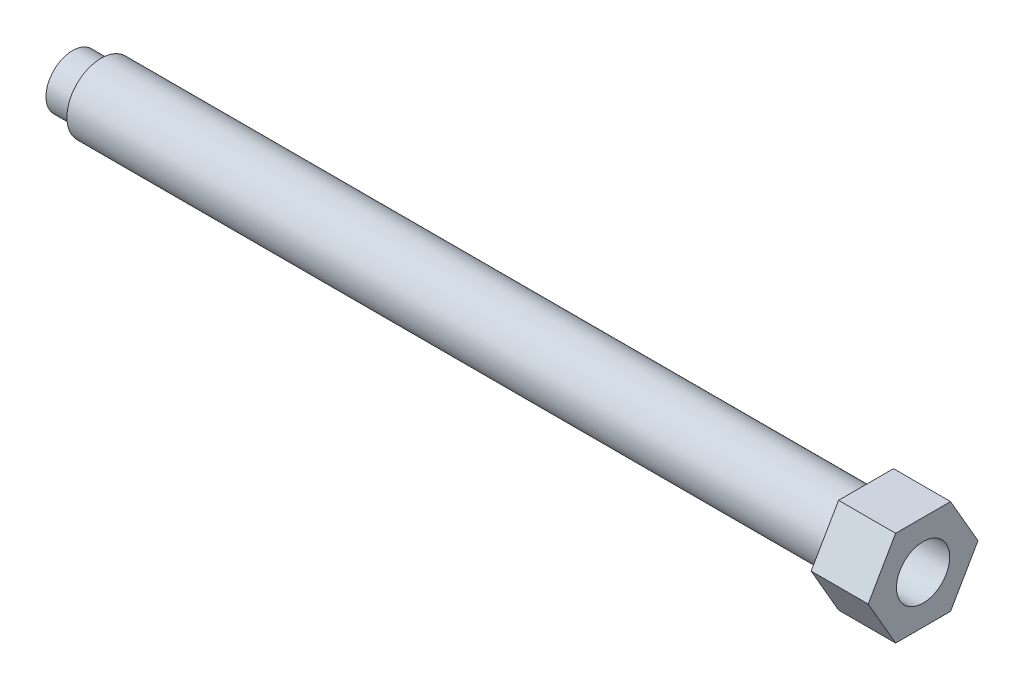
from build123d import *
from build123d.topology import SkipClean

# Parameters (mm, degrees)
SWEEP_THIN1_PROFILE_R   = 11.43
SWEEP_THIN1_PROFILE_R_2 = 6.35
SKETCH14_R              = 8.89
BOSS_EXTRUDE1_DEPTH     = 19.05
SKETCH15_R              = 8.89
SKETCH15_R_2            = 6.35
BOSS_EXTRUDE2_DEPTH     = 9.525


with BuildPart() as part:
    # Sweep-Thin1: sweep along a curve in space
    with BuildLine() as sweep_thin1_path:
        Line((-127.687371879, 0, 0), (127.687371879, 0, 0))
    # Sweep-Thin1 profile (on start of the path) → Sweep-Thin1 (sweep)
    with BuildSketch(Plane(origin=(-127.687371879, 0, 0), x_dir=(0, 0, 1), z_dir=(1, 0, 0))):
        Circle(SWEEP_THIN1_PROFILE_R)
        Circle(SWEEP_THIN1_PROFILE_R_2, mode=Mode.SUBTRACT)
    sweep(path=sweep_thin1_path.line)

    # Sketch14 → Boss-Extrude1 (add)
    with BuildSketch(Plane(origin=(127.687371879, 0, 0), x_dir=(0, 0, -1), z_dir=(1, 0, 0))):
        Polygon((9.165435523, 15.875), (-9.165435523, 15.875), (-18.330871047, 0), (-9.165435523, -15.875), (9.165435523, -15.875), (18.330871047, 0), align=None)
        with Locations(Location((0, 0, 0), (0, 0, 180))):
            Circle(SKETCH14_R, mode=Mode.SUBTRACT)
    extrude(amount=BOSS_EXTRUDE1_DEPTH)

    # Sketch15 → Boss-Extrude2 (add)
    with SkipClean():  # the faces are left unmerged after this step: merging them gives an invalid solid
        with BuildSketch(Plane.ZY.offset(127.687371879)):
            Circle(SKETCH15_R)
            with Locations(Location((0, 0, 0), (0, 0, 180))):
                Circle(SKETCH15_R_2, mode=Mode.SUBTRACT)
        extrude(amount=BOSS_EXTRUDE2_DEPTH)


solid = part.part
